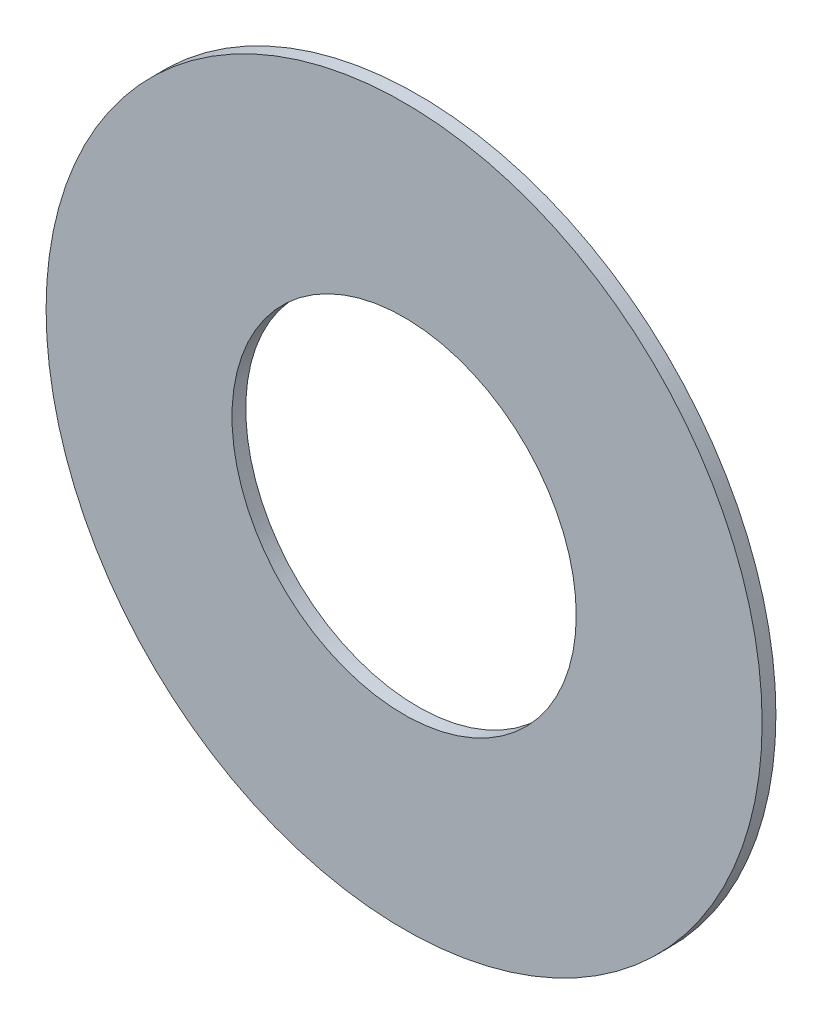
from build123d import *

# Parameters (mm, degrees)
IZIM1_R                     = 26
IZIM1_R_2                   = 12.5
Y_KSEKLIK_EKSTR_ZYON1_DEPTH = 1


with BuildPart() as part:
    # Çizim1 → Yükseklik-Ekstrüzyon1 (new body)
    with BuildSketch(Plane.XY):
        Circle(IZIM1_R)
        Circle(IZIM1_R_2, mode=Mode.SUBTRACT)
    extrude(amount=Y_KSEKLIK_EKSTR_ZYON1_DEPTH)


solid = part.part
